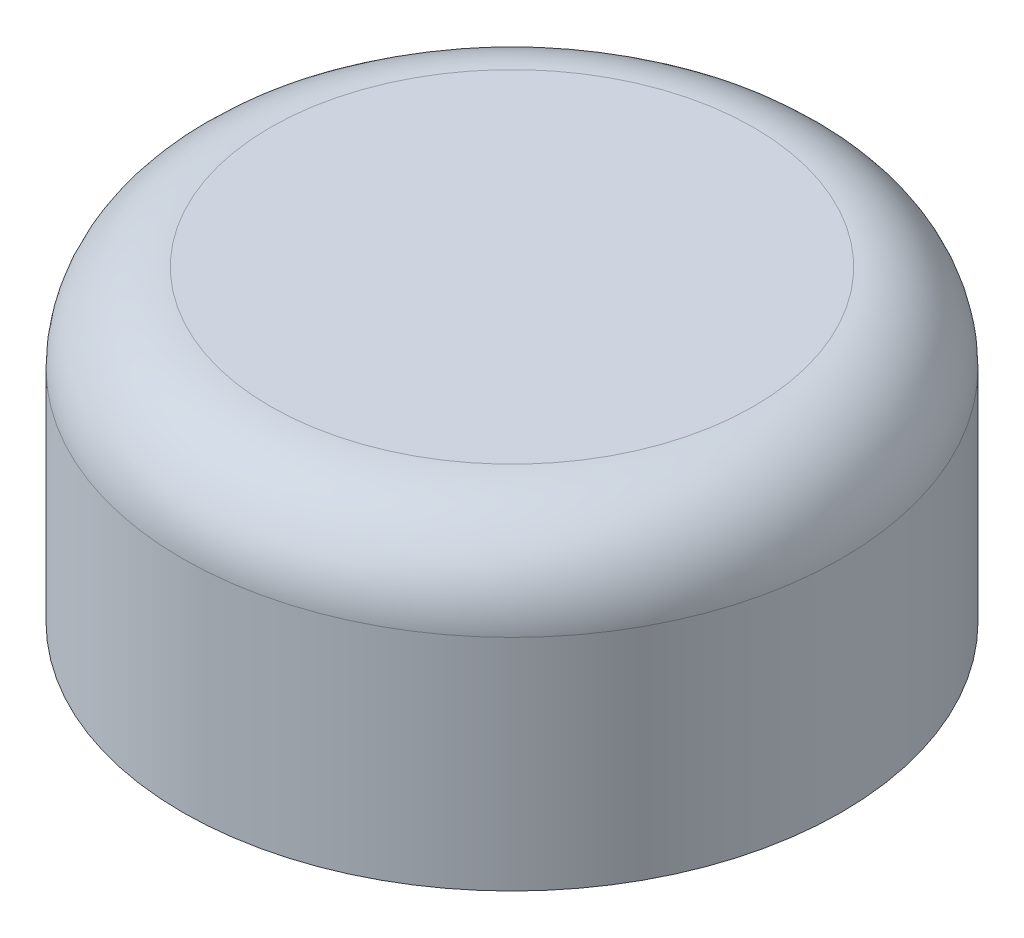
from build123d import *

# Parameters (mm, degrees)
SKETCH1_R           = 37.5
BOSS_EXTRUDE1_DEPTH = 17.5
FILLET1_R           = 10


with BuildPart() as part:
    # Sketch1 → Boss-Extrude1 (new, symmetric)
    with BuildSketch(Plane(origin=(0, 0, 0), x_dir=(1, 0, 0), z_dir=(0, 1, 0))):
        with Locations(Location((0, 0, 0), (0, 0, 270))):
            Circle(SKETCH1_R)
    extrude(amount=BOSS_EXTRUDE1_DEPTH, both=True)

    # Fillet1
    fillet1_edges = [part.edges().sort_by_distance(p)[0] for p in [
        (0, 17.5, -37.5),
    ]]
    fillet(fillet1_edges, radius=FILLET1_R)


solid = part.part
